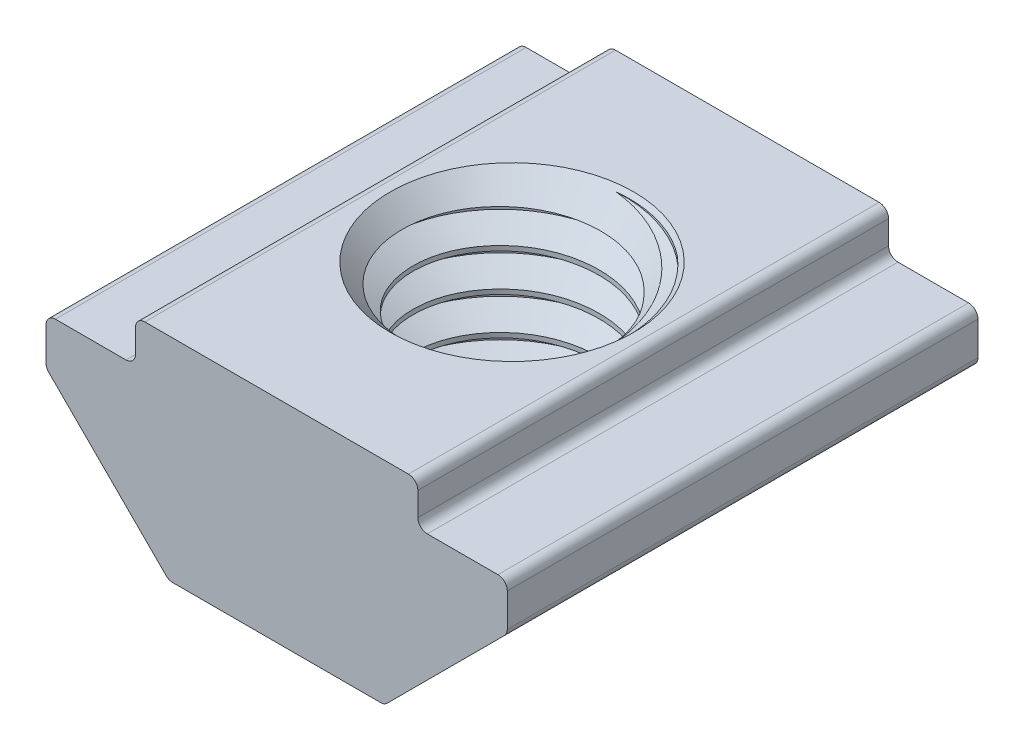
from build123d import *

# Parameters (mm, degrees)
BOSS_EXTRUDE1_START          = 5
BOSS_EXTRUDE1_DEPTH          = 10
FILLET1_R                    = 0.2
SKETCH4_R                    = 2.5
CUT_EXTRUDE1_DEPTH           = 9.322259
SKETCH5_R                    = 2.586603
CUT_EXTRUDE2_DEPTH           = 2.54
CUT_EXTRUDE2_DRAFT           = -45
CUT_EXTRUDE6_START           = -0.266667
SKETCH11_R                   = 2.586603
CUT_EXTRUDE6_DEPTH           = 2.54
CUT_EXTRUDE6_DRAFT           = -45
SWEEP1_PITCH                 = 0.8
SWEEP1_HEIGHT                = 5.4
SWEEP1_RADIUS                = 2.5
SKETCH8_R                    = 2.586603
CUT_EXTRUDE3_OTHER_WAY_DEPTH = 9.856671
SKETCH9_R                    = 2.853269
CUT_EXTRUDE4_OTHER_WAY_DEPTH = 9.322259


with BuildPart() as part:
    # Sketch3 → Boss-Extrude1 (new body)
    with BuildSketch(Plane.XY.offset(BOSS_EXTRUDE1_START)):
        Polygon((-4.9, 1.35), (-3, 1.35), (-3, 2.25), (3, 2.25), (3, 1.35), (4.9, 1.35), (4.9, 0.36), (2.29, -2.25), (-2.29, -2.25), (-4.9, 0.36), align=None)
    extrude(amount=-BOSS_EXTRUDE1_DEPTH)

    # Fillet1
    fillet1_edges = [part.edges().sort_by_distance(p)[0] for p in [
        (-4.9, 1.35, 0),
        (-3, 1.35, 0),
        (-3, 2.25, 0),
        (3, 2.25, 0),
        (3, 1.35, 0),
        (4.9, 1.35, 0),
        (4.9, 0.36, 0),
        (2.29, -2.25, 0),
        (-2.29, -2.25, 0),
        (-4.9, 0.36, 0),
    ]]
    fillet(fillet1_edges, radius=FILLET1_R)

    # Sketch4 → Cut-Extrude1 (cut, through all)
    with BuildSketch(Plane(origin=(0, 2.25, 0), x_dir=(1, 0, 0), z_dir=(0, 1, 0))):
        with Locations(Location((0, 0, 0), (0, 0, 270))):
            Circle(SKETCH4_R)
    extrude(amount=-CUT_EXTRUDE1_DEPTH, mode=Mode.SUBTRACT)


with BuildPart() as cut_extrude2_tool:
    # Sketch5 → Cut-Extrude2 (with draft: the straight prism first)
    with BuildSketch(Plane(origin=(0, 2.25, 0), x_dir=(1, 0, 0), z_dir=(0, 1, 0))):
        Circle(SKETCH5_R)
    extrude(amount=-CUT_EXTRUDE2_DEPTH)
    # Cut-Extrude2: the draft: its side faces are tilted about the plane it starts from
    cut_extrude2_sides = [cut_extrude2_tool.faces().sort_by_distance(p)[0] for p in [
        (-2.586603, 0.98, 0),
    ]]
    draft(cut_extrude2_sides, Plane(origin=(0, 2.25, 0), x_dir=(1, 0, 0), z_dir=(0, 1, 0)), CUT_EXTRUDE2_DRAFT)


with BuildPart() as part_1:
    add(part.part)

    # Cut-Extrude2: cut by cut_extrude2_tool
    add(cut_extrude2_tool.part, mode=Mode.SUBTRACT)


with BuildPart() as cut_extrude6_tool:
    # Sketch11 → Cut-Extrude6 (with draft: the straight prism first)
    with BuildSketch(Plane.XZ.offset(2.25).offset(CUT_EXTRUDE6_START)):
        Circle(SKETCH11_R)
    extrude(amount=CUT_EXTRUDE6_DEPTH)
    # Cut-Extrude6: the draft: its side faces are tilted about the plane it starts from
    cut_extrude6_sides = [cut_extrude6_tool.faces().sort_by_distance(p)[0] for p in [
        (-2.586603, -3.253333, 0),
    ]]
    draft(cut_extrude6_sides, Plane.XZ.offset(2.25).offset(CUT_EXTRUDE6_START), CUT_EXTRUDE6_DRAFT)


with BuildPart() as part_2:
    add(part_1.part)

    # Cut-Extrude6: cut by cut_extrude6_tool
    add(cut_extrude6_tool.part, mode=Mode.SUBTRACT)

    # Sweep1: sweep along a helix
    with BuildLine() as sweep1_path:
        Helix(SWEEP1_PITCH, SWEEP1_HEIGHT, SWEEP1_RADIUS, center=(0, 2.25, 0), direction=(0, -1, 0))
    # Sketch7 → Sweep1 (sweep)
    with BuildSketch(Plane(origin=(0, 0, 0), x_dir=(0, 0, -1), z_dir=(1, 0, 0))):
        Polygon((1.980385, 2.65), (1.980385, 2.55), (2.543301, 2.225), (2.543301, 2.975), align=None)
    sweep(path=sweep1_path.line, is_frenet=True)

    # Cut-Extrude3 cone 1 section (through the dimple's axis) → Cut-Extrude3 (revolve, cut)
    with BuildSketch(Plane(origin=(0, 2.25, 0), x_dir=(0, 0, 1), z_dir=(1, 0, 0))):
        Polygon((0, 0), (2.586603, 0), (0, 2.586603), align=None)
    revolve(axis=Axis((0, 2.25, 0), (0, -1, 0)), mode=Mode.SUBTRACT)

    # Sketch8 → Cut-Extrude3 other way (cut)
    with BuildSketch(Plane(origin=(0, 2.25, 0), x_dir=(1, 0, 0), z_dir=(0, 1, 0))):
        Circle(SKETCH8_R)
    extrude(amount=CUT_EXTRUDE3_OTHER_WAY_DEPTH, mode=Mode.SUBTRACT)

    # Cut-Extrude4 cone 1 section (through the dimple's axis) → Cut-Extrude4 (revolve, cut)
    with BuildSketch(Plane(origin=(0, -2.25, 0), x_dir=(0, 0, -1), z_dir=(1, 0, 0))):
        Polygon((0, 0), (2.853269, 0), (0, 2.853269), align=None)
    revolve(axis=Axis((0, -2.25, 0), (0, 1, 0)), mode=Mode.SUBTRACT)

    # Sketch9 → Cut-Extrude4 other way (cut)
    with BuildSketch(Plane.XZ.offset(2.25)):
        Circle(SKETCH9_R)
    extrude(amount=CUT_EXTRUDE4_OTHER_WAY_DEPTH, mode=Mode.SUBTRACT)


solid = part_2.part
